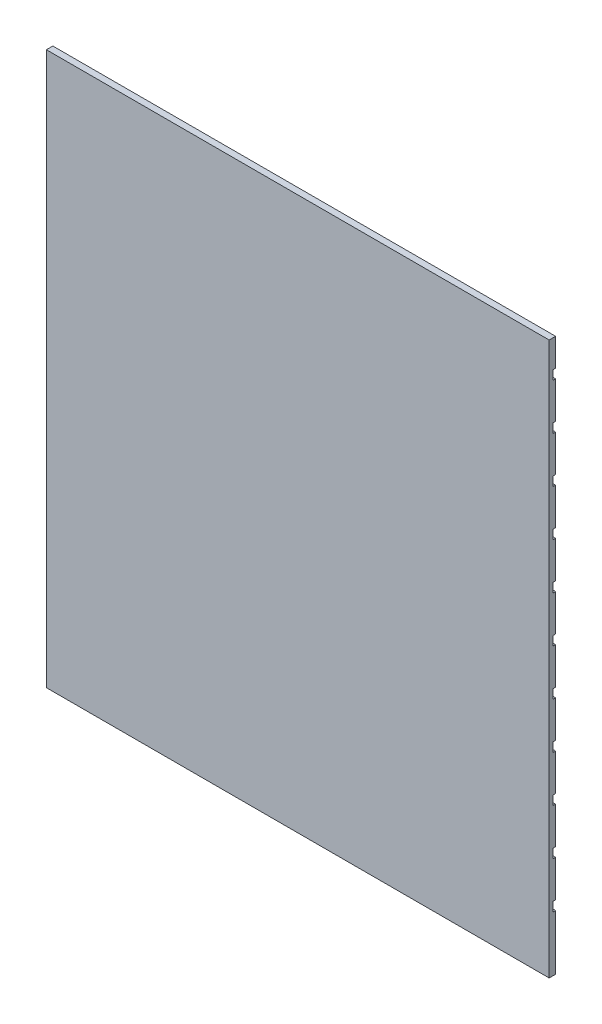
from build123d import *

# Parameters (mm, degrees)
SKETCH2_W           = 17.78
SKETCH2_H           = 1524
BOSS_EXTRUDE1_DEPTH = 1386.84
SKETCH3_W           = 1386.84
SKETCH3_H           = 25.4
CUT_EXTRUDE1_DEPTH  = 7.62


with BuildPart() as part:
    # Sketch2 → Boss-Extrude1 (new body)
    with BuildSketch(Plane(origin=(0, 0, 0), x_dir=(0, 0, -1), z_dir=(1, 0, 0))):
        with Locations((8.89, -762)):
            Rectangle(SKETCH2_W, SKETCH2_H)
    extrude(amount=BOSS_EXTRUDE1_DEPTH)

    # Sketch3 → Cut-Extrude1 (cut)
    with BuildSketch(Plane(origin=(0, 0, -17.78), x_dir=(-1, 0, 0), z_dir=(0, 0, -1))):
        with Locations((-693.42, -88.9)):
            Rectangle(SKETCH3_W, SKETCH3_H)
        with Locations((-693.42, -215.9)):
            Rectangle(SKETCH3_W, SKETCH3_H)
        with Locations((-693.42, -342.9)):
            Rectangle(SKETCH3_W, SKETCH3_H)
        with Locations((-693.42, -469.9)):
            Rectangle(SKETCH3_W, SKETCH3_H)
        with Locations((-693.42, -596.9)):
            Rectangle(SKETCH3_W, SKETCH3_H)
        with Locations((-693.42, -723.9)):
            Rectangle(SKETCH3_W, SKETCH3_H)
        with Locations((-693.42, -850.9)):
            Rectangle(SKETCH3_W, SKETCH3_H)
        with Locations((-693.42, -977.9)):
            Rectangle(SKETCH3_W, SKETCH3_H)
        with Locations((-693.42, -1104.9)):
            Rectangle(SKETCH3_W, SKETCH3_H)
        with Locations((-693.42, -1231.9)):
            Rectangle(SKETCH3_W, SKETCH3_H)
        with Locations((-693.42, -1358.9)):
            Rectangle(SKETCH3_W, SKETCH3_H)
    extrude(amount=-CUT_EXTRUDE1_DEPTH, mode=Mode.SUBTRACT)


solid = part.part
